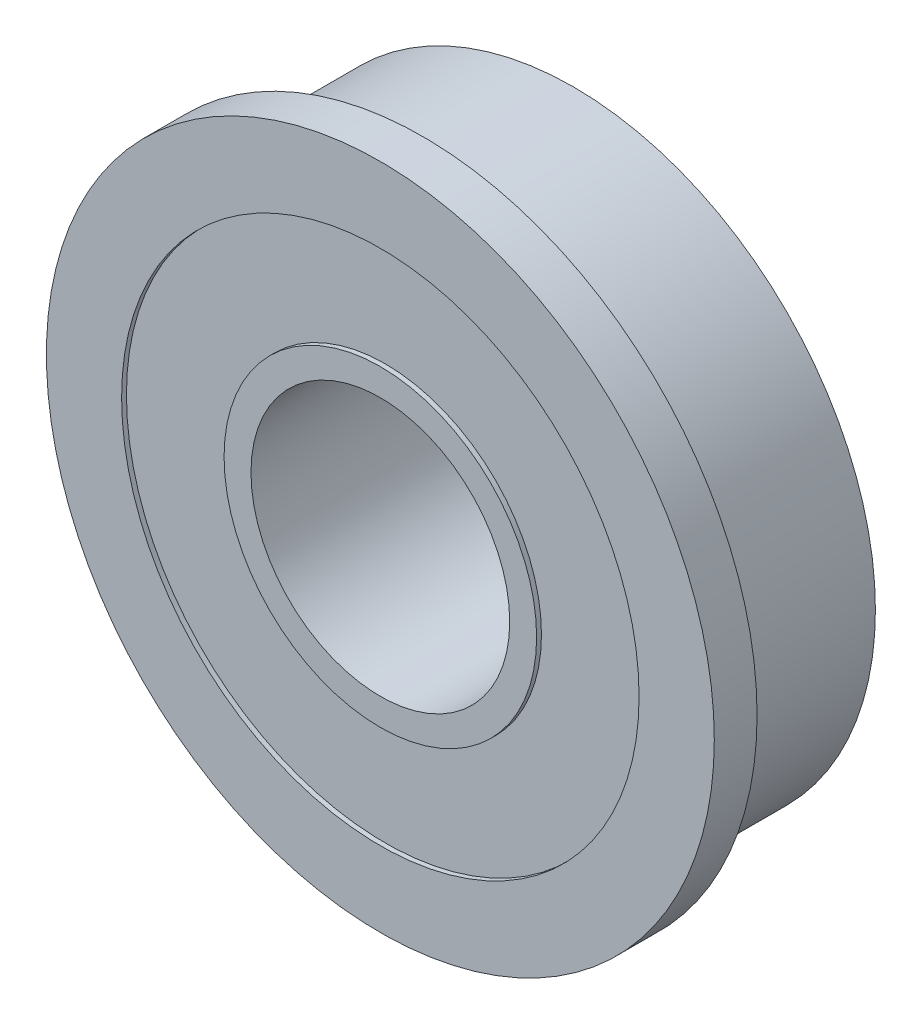
from build123d import *


with BuildPart() as part:
    # Sketch1 → Revolve1 (revolve)
    with BuildSketch(Plane(origin=(0, 0, 0), x_dir=(1, 0, 0), z_dir=(0, 1, 0))):
        Polygon((4.7625, -3.556), (5.7531, -3.556), (5.7531, -3.3782), (9.525, -3.3782), (9.525, -3.556), (12.2936, -3.556), (12.2936, -1.9812), (11.1125, -1.9812), (11.1125, 3.556), (9.525, 3.556), (9.525, 3.3782), (5.7531, 3.3782), (5.7531, 3.556), (4.7625, 3.556), align=None)
    revolve(axis=Axis((0, 0, -3.556), (0, 0, 1)))


solid = part.part
